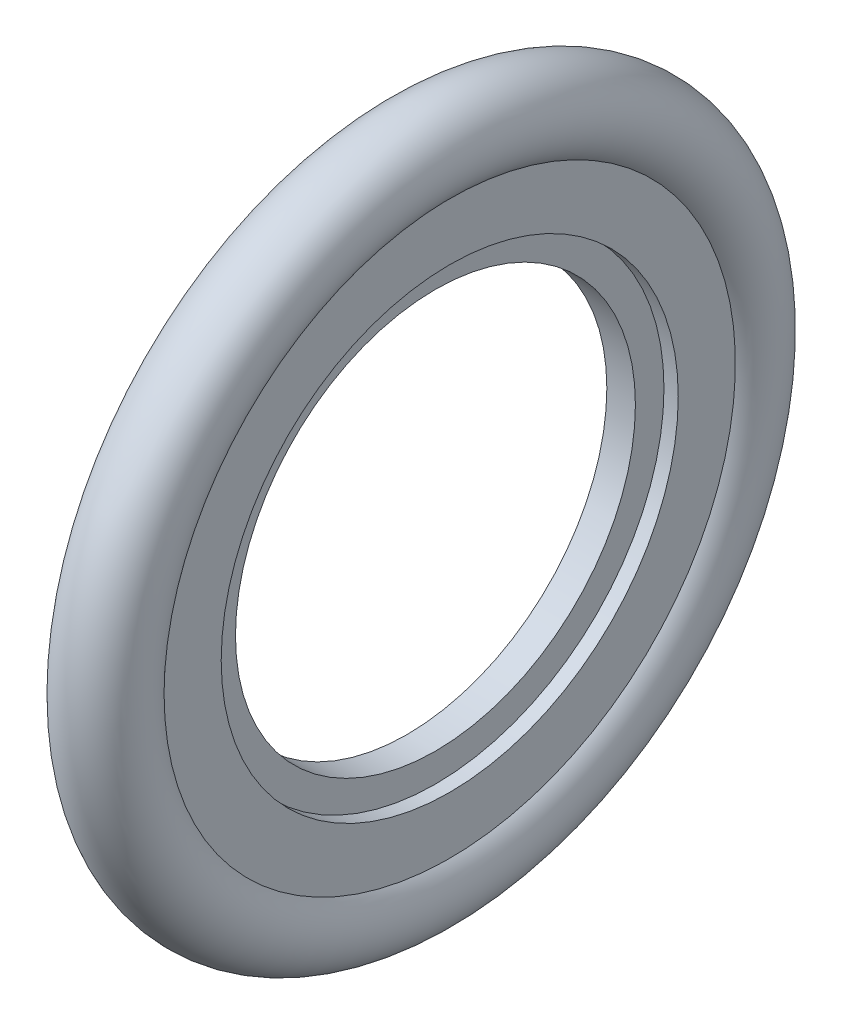
from build123d import *


with BuildPart() as part:
    # Sketch1 → Revolve1 (revolve)
    with BuildSketch(Plane.XY, mode=Mode.PRIVATE) as revolve1_sk:
        with BuildLine():
            ThreePointArc((-6.35, 63.5), (0, 79.375), (6.35, 63.5))
            Line((6.35, 63.5), (6.35, 50.8))
            Line((6.35, 50.8), (3.175, 50.8))
            Line((3.175, 50.8), (3.175, 44.45))
            Line((3.175, 44.45), (-3.175, 44.45))
            Line((-3.175, 44.45), (-3.175, 50.8))
            Line((-3.175, 50.8), (-6.35, 50.8))
            Line((-6.35, 50.8), (-6.35, 63.5))
        make_face()
    revolve(revolve1_sk.sketch.rotate(Axis((0, 0, 0), (1, 0, 0)), 90), axis=Axis((0, 0, 0), (1, 0, 0)))


solid = part.part
